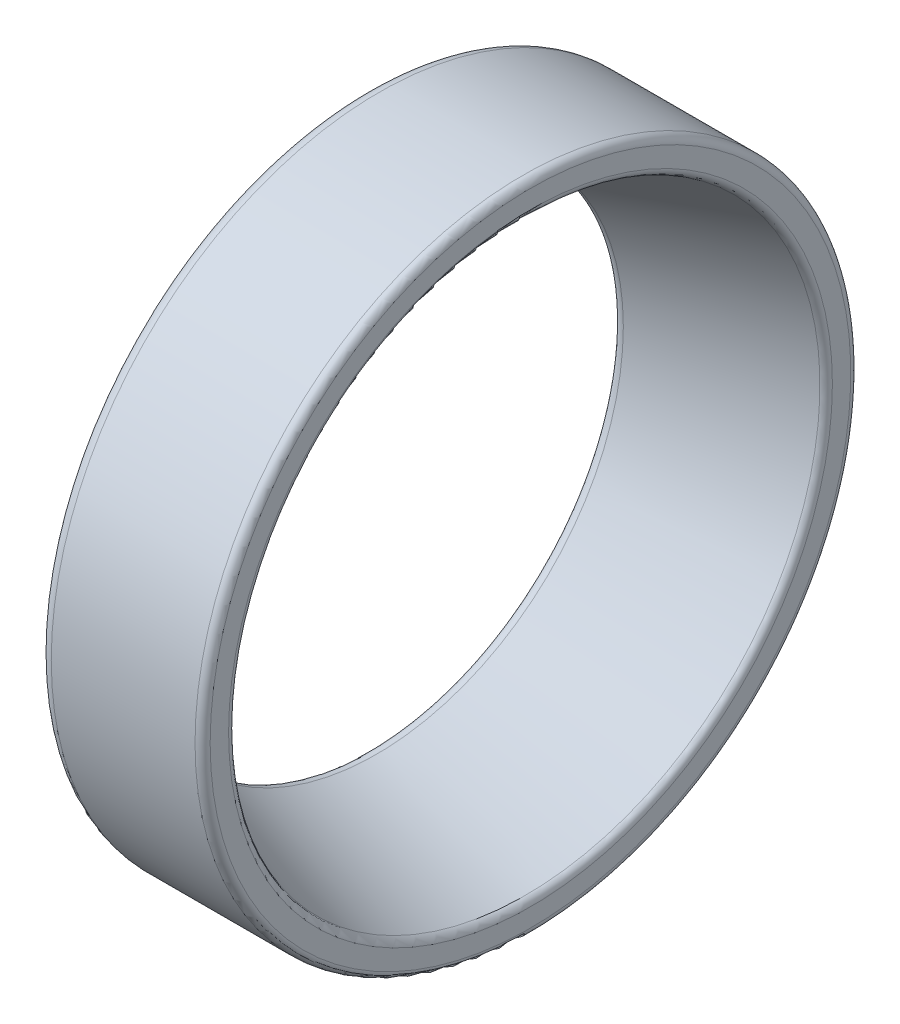
from build123d import *


with BuildPart() as part:
    # Esquisse1 → Base-Révolution (revolve)
    with BuildSketch(Plane.XY, mode=Mode.PRIVATE) as base_r_volution_sk:
        with BuildLine():
            Line((-15.221462778, 26), (-3.821462778, 26))
            ThreePointArc((-3.821462778, 26), (-3.397198709, 25.824264069), (-3.221462778, 25.4))
            Line((-3.221462778, 25.4), (-3.221462778, 23.938910031))
            ThreePointArc((-3.221462778, 23.938910031), (-3.33666592, 23.585396231), (-3.638036135, 23.367635433))
            Line((-3.638036135, 23.367635433), (-15.438036135, 19.578854348))
            ThreePointArc((-15.438036135, 19.578854348), (-15.974976578, 19.665332089), (-16.221462778, 20.150128946))
            Line((-16.221462778, 20.150128946), (-16.221462778, 25))
            ThreePointArc((-16.221462778, 25), (-15.928569559, 25.707106781), (-15.221462778, 26))
        make_face()
    revolve(base_r_volution_sk.sketch.rotate(Axis((-17.990056753, 0, 0), (1, 0, 0)), 90), axis=Axis((-17.990056753, 0, 0), (1, 0, 0)))


solid = part.part
